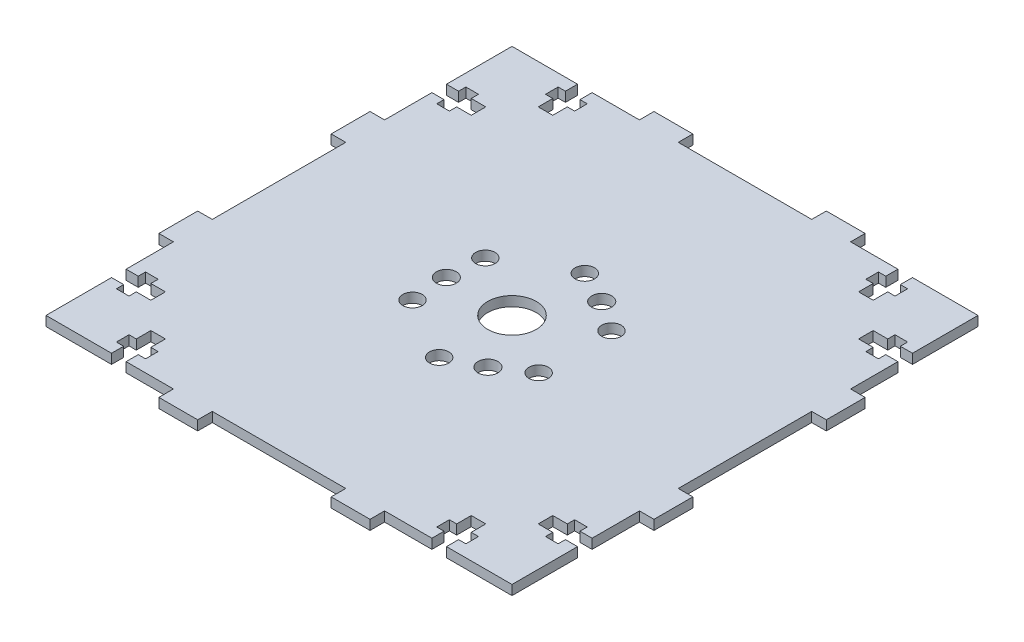
from build123d import *

# Parameters (mm, degrees)
SKETCH_1_R      = 2
SKETCH_1_R_2    = 2.05
SKETCH_1_R_3    = 5
EXTRUDE_1_DEPTH = 2


with BuildPart() as part:
    # 草图1 → 凸台-拉伸1 (new body)
    with BuildSketch(Plane(origin=(0, 0, 0), x_dir=(1, 0, 0), z_dir=(0, 1, 0))):
        Polygon((-31.5, -48), (-21.75, -48), (-21.75, -51), (-13.75, -51), (-13.75, -48), (13.75, -48), (13.75, -51), (21.75, -51), (21.75, -48), (31.5, -48), (31.5, -45.5), (30, -45.5), (30, -42.9), (31.5, -42.9), (31.5, -39.9), (34.5, -39.9), (34.5, -42.9), (36, -42.9), (36, -45.5), (34.5, -45.5), (34.5, -48), (35.5, -48), (47.5, -48), (48, -48), (48, -35.5), (48, -34.5), (45.5, -34.5), (45.5, -36), (42.9, -36), (42.9, -34.5), (39.9, -34.5), (39.9, -31.5), (42.9, -31.5), (42.9, -30), (45.5, -30), (45.5, -31.5), (48, -31.5), (48, -21.75), (51, -21.75), (51, -13.75), (48, -13.75), (48, 13.75), (51, 13.75), (51, 21.75), (48, 21.75), (48, 31.5), (45.5, 31.5), (45.5, 30), (42.9, 30), (42.9, 31.5), (39.9, 31.5), (39.9, 34.5), (42.9, 34.5), (42.9, 36), (45.5, 36), (45.5, 34.5), (48, 34.5), (48, 46.5), (48, 48), (35.5, 48), (34.5, 48), (34.5, 45.5), (36, 45.5), (36, 42.9), (34.5, 42.9), (34.5, 39.9), (31.5, 39.9), (31.5, 42.9), (30, 42.9), (30, 45.5), (31.5, 45.5), (31.5, 48), (21.75, 48), (21.75, 51), (13.75, 51), (13.75, 48), (-13.75, 48), (-13.75, 51), (-21.75, 51), (-21.75, 48), (-31.5, 48), (-31.5, 45.5), (-30, 45.5), (-30, 42.9), (-31.5, 42.9), (-31.5, 39.9), (-34.5, 39.9), (-34.5, 42.9), (-36, 42.9), (-36, 45.5), (-34.5, 45.5), (-34.5, 48), (-42.9, 48), (-48, 48), (-48, 47), (-48, 34.5), (-45.5, 34.5), (-45.5, 36), (-42.9, 36), (-42.9, 34.5), (-39.9, 34.5), (-39.9, 31.5), (-42.9, 31.5), (-42.9, 30), (-45.5, 30), (-45.5, 31.5), (-48, 31.5), (-48, 21.75), (-51, 21.75), (-51, 13.75), (-48, 13.75), (-48, -13.75), (-51, -13.75), (-51, -21.75), (-48, -21.75), (-48, -31.5), (-45.5, -31.5), (-45.5, -30), (-42.9, -30), (-42.9, -31.5), (-39.9, -31.5), (-39.9, -34.5), (-42.9, -34.5), (-42.9, -36), (-45.5, -36), (-45.5, -34.5), (-48, -34.5), (-48, -35.5), (-48, -48), (-47, -48), (-34.5, -48), (-34.5, -45.5), (-36, -45.5), (-36, -42.9), (-34.5, -42.9), (-34.5, -39.9), (-31.5, -39.9), (-31.5, -42.9), (-30, -42.9), (-30, -45.5), (-31.5, -45.5), align=None)
        with Locations(Location((0, -15, 0), (0, 0, 270))):
            Circle(SKETCH_1_R, mode=Mode.SUBTRACT)
        with Locations(Location((-12.990381057, -7.5, 0), (0, 0, 270))):
            Circle(SKETCH_1_R, mode=Mode.SUBTRACT)
        with Locations(Location((-12.990381057, 7.5, 0), (0, 0, 270))):
            Circle(SKETCH_1_R, mode=Mode.SUBTRACT)
        with Locations(Location((0, 15, 0), (0, 0, 270))):
            Circle(SKETCH_1_R, mode=Mode.SUBTRACT)
        with Locations(Location((12.990381057, 7.5, 0), (0, 0, 270))):
            Circle(SKETCH_1_R, mode=Mode.SUBTRACT)
        with Locations(Location((12.990381057, -7.5, 0), (0, 0, 270))):
            Circle(SKETCH_1_R, mode=Mode.SUBTRACT)
        with Locations(Location((-13.53, 0, 0), (0, 0, 270))):
            Circle(SKETCH_1_R_2, mode=Mode.SUBTRACT)
        with Locations(Location((6.765, 11.717323713, 0), (0, 0, 270))):
            Circle(SKETCH_1_R_2, mode=Mode.SUBTRACT)
        with Locations(Location((6.765, -11.717323713, 0), (0, 0, 270))):
            Circle(SKETCH_1_R_2, mode=Mode.SUBTRACT)
        with Locations(Location((0, 0, 0), (0, 0, 270))):
            Circle(SKETCH_1_R_3, mode=Mode.SUBTRACT)
    extrude(amount=EXTRUDE_1_DEPTH)


solid = part.part
